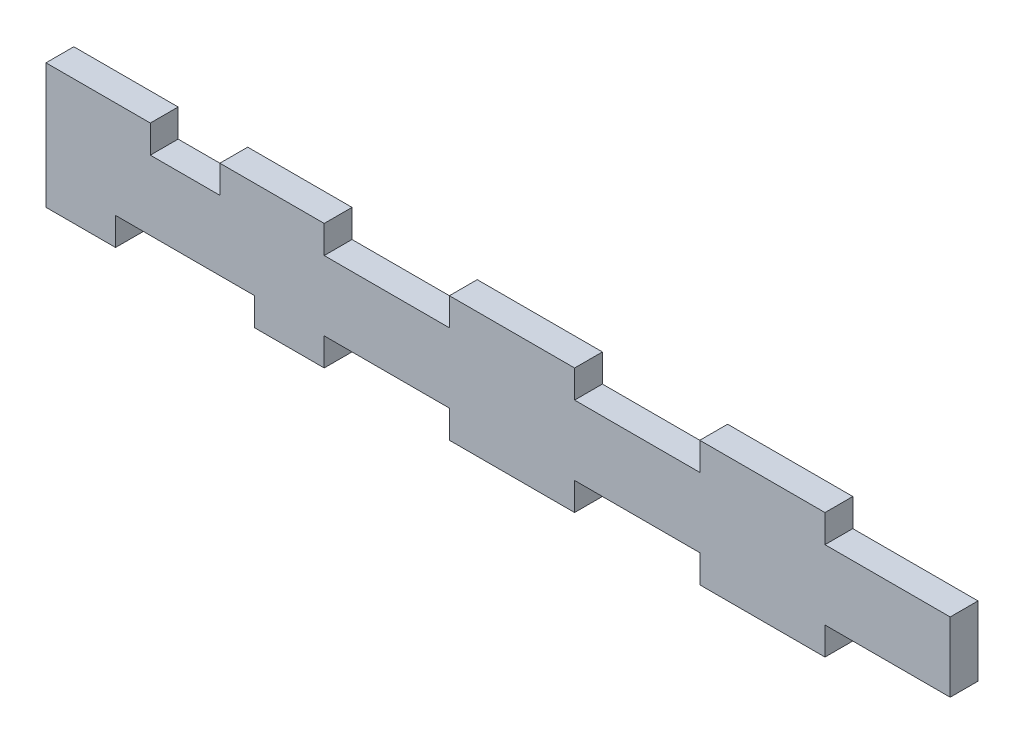
from build123d import *

# Parameters (mm, degrees)
SKETCH1_W           = 40
SKETCH1_H           = 40
BOSS_EXTRUDE1_DEPTH = 2
SKETCH2_R           = 1.5
CUT_EXTRUDE1_DEPTH  = 29.565713714
SKETCH3_W           = 4
SKETCH3_H           = 10
SKETCH3_W_2         = 10
SKETCH3_H_2         = 4
CUT_EXTRUDE2_DEPTH  = 29.565713714
SKETCH4_W           = 10
SKETCH4_H           = 4
BOSS_EXTRUDE2_DEPTH = 4
BOSS_EXTRUDE3_DEPTH = 4
SKETCH6_W           = 40
SKETCH6_H           = 26
CUT_EXTRUDE3_DEPTH  = 113.658776844
SKETCH7_W           = 4
SKETCH7_H           = 9
BOSS_EXTRUDE4_DEPTH = 4


with BuildPart() as part:
    # Sketch1 → Boss-Extrude1 (new, symmetric)
    with BuildSketch(Plane.XY):
        Rectangle(SKETCH1_W, SKETCH1_H)
    extrude(amount=BOSS_EXTRUDE1_DEPTH, both=True)

    # Sketch2 → Cut-Extrude1 (cut, through all)
    with BuildSketch(Plane.XY.offset(2)):
        with Locations((12, 14.35)):
            Circle(SKETCH2_R)
        with Locations((12, -3.15)):
            Circle(SKETCH2_R)
    extrude(amount=-CUT_EXTRUDE1_DEPTH, mode=Mode.SUBTRACT)

    # Sketch3 → Cut-Extrude2 (cut, through all)
    with BuildSketch(Plane.XY.offset(2)):
        with Locations((18, 10)):
            Rectangle(SKETCH3_W, SKETCH3_H)
        with Locations((-18, 10)):
            Rectangle(SKETCH3_W, SKETCH3_H)
        with Locations((-18, -10)):
            Rectangle(SKETCH3_W, SKETCH3_H)
        with Locations((18, -10)):
            Rectangle(SKETCH3_W, SKETCH3_H)
        with Locations((0, -8)):
            Rectangle(SKETCH3_W_2, SKETCH3_H_2)
    extrude(amount=-CUT_EXTRUDE2_DEPTH, mode=Mode.SUBTRACT)

    # Sketch4 → Boss-Extrude2 (add)
    with BuildSketch(Plane.XY.offset(2)):
        with Locations((-15, -22)):
            Rectangle(SKETCH4_W, SKETCH4_H)
        with Locations((15, -22)):
            Rectangle(SKETCH4_W, SKETCH4_H)
    extrude(amount=-BOSS_EXTRUDE2_DEPTH)

    # Sketch5 → Boss-Extrude3 (add)
    with BuildSketch(Plane.XY.offset(2)):
        Polygon((20, -20), (38, -20), (38, -24), (56, -24), (56, -20), (74, -20), (74, -24), (92, -24), (92, -20), (110, -20), (110, -10), (92, -10), (92, -6), (74, -6), (74, -10), (56, -10), (56, -6), (38, -6), (38, -10), (20, -10), align=None)
    extrude(amount=-BOSS_EXTRUDE3_DEPTH)

    # Sketch6 → Cut-Extrude3 (cut, through all)
    with BuildSketch(Plane.XY.offset(2)):
        with Locations((0, 7)):
            Rectangle(SKETCH6_W, SKETCH6_H)
    extrude(amount=-CUT_EXTRUDE3_DEPTH, mode=Mode.SUBTRACT)

    # Sketch7 → Boss-Extrude4 (add)
    with BuildSketch(Plane.XY.offset(2)):
        with Locations((18, -10.5)):
            Rectangle(SKETCH7_W, SKETCH7_H)
        with Locations((-18, -10.5)):
            Rectangle(SKETCH7_W, SKETCH7_H)
    extrude(amount=-BOSS_EXTRUDE4_DEPTH)


solid = part.part
